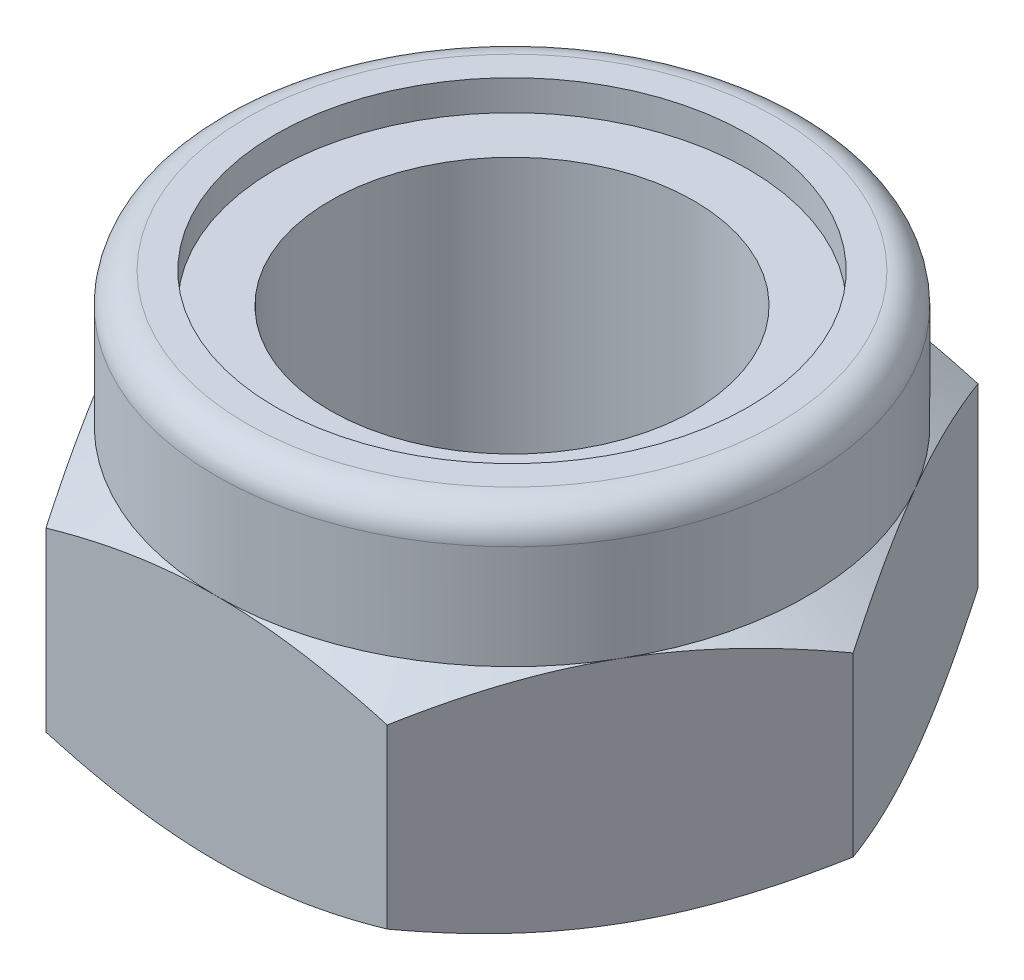
from build123d import *

# Parameters (mm, degrees)
EXTRUDE1_DEPTH     = 2.525
CUT_EXTRUDE1_REACH = 14.751
SKETCH4_R          = 4


with BuildPart() as part:
    # Sketch1 → Extrude1 (new, symmetric)
    with BuildSketch(Plane(origin=(0, 0, 0), x_dir=(1, 0, 0), z_dir=(0, 1, 0))):
        Polygon((3.75277675, 6.5), (-3.75277675, 6.5), (-7.505553499, 0), (-3.75277675, -6.5), (3.75277675, -6.5), (7.505553499, 0), align=None)
    extrude(amount=EXTRUDE1_DEPTH, both=True)

    # Sketch2 → Cut-Revolve1 (revolve, cut)
    with BuildSketch(Plane.XY):
        Polygon((7.505553499, 2.525), (6.5, 2.525), (7.505553499, 1.944443416), align=None)
    cut_revolve1 = revolve(axis=Axis((0, 2.75, 0), (0, -1, 0)), mode=Mode.SUBTRACT)

    # Mirror1: Cut-Revolve1 across plane
    add(cut_revolve1.mirror(Plane.ZX), mode=Mode.SUBTRACT)

    # Sketch3 → Revolve1 (revolve)
    with BuildSketch(Plane.XY, mode=Mode.PRIVATE) as revolve1_sk:
        with BuildLine():
            Line((0, 2.525), (0, 4.808333333))
            Line((0, 4.808333333), (5.2, 4.808333333))
            Line((5.2, 4.808333333), (5.2, 5.475))
            Line((5.2, 5.475), (5.833333333, 5.475))
            ThreePointArc((5.833333333, 5.475), (6.304737854, 5.279737854), (6.5, 4.808333333))
            Line((6.5, 4.808333333), (6.5, 2.525))
            Line((6.5, 2.525), (0, 2.525))
        make_face()
    revolve(revolve1_sk.sketch.rotate(Axis((0, 2.75, 0), (0, -1, 0)), 90), axis=Axis((0, 2.75, 0), (0, -1, 0)))

    # Sketch4 → Cut-Extrude1 (cut, up to next)
    with BuildSketch(Plane.XZ.offset(2.525), mode=Mode.PRIVATE) as cut_extrude1_sk1:
        with Locations(Location((0, 0, 0), (0, 0, 270))):
            Circle(SKETCH4_R)
    cut_extrude1_tool1 = extrude(cut_extrude1_sk1.sketch, amount=-CUT_EXTRUDE1_REACH, mode=Mode.PRIVATE) & part.part
    add(cut_extrude1_tool1.solids().sort_by_distance((0, -2.525, 0))[0], mode=Mode.SUBTRACT)


solid = part.part
